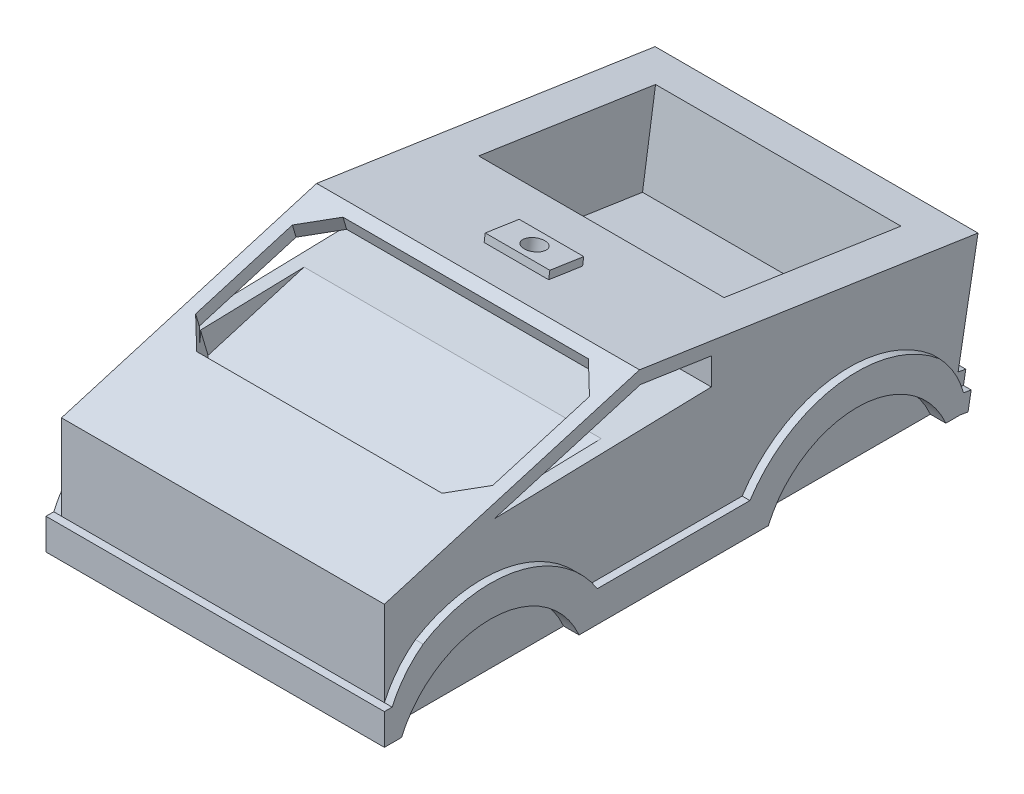
from build123d import *

# Parameters (mm, degrees)
BOSS_EXTRUDE1_DEPTH = 125
CUT_EXTRUDE1_DEPTH  = 17
SKETCH3_W           = 95
SKETCH3_H           = 69.22757419
CUT_EXTRUDE2_DEPTH  = 34
SKETCH4_W           = 25
SKETCH4_H           = 13.27242581
BOSS_EXTRUDE2_DEPTH = 3
SKETCH5_R           = 4
CUT_EXTRUDE3_DEPTH  = 26
SKETCH6_R           = 37.5
CUT_EXTRUDE4_DEPTH  = 3
BOSS_EXTRUDE3_DEPTH = 3
BOSS_EXTRUDE4_DEPTH = 3
BOSS_EXTRUDE5_DEPTH = 3


with BuildPart() as part:
    # Sketch1 → Boss-Extrude1 (new body)
    with BuildSketch(Plane(origin=(0, 0, 0), x_dir=(0, 0, -1), z_dir=(1, 0, 0))):
        Polygon((0, 0), (-220, 0), (-220, 45), (-121.223885949, 74.203491429), (9.810612088, 54.551256842), align=None)
        Polygon((-177.49762675, 52.35202023), (-120.869266543, 69.094386012), (-93.423815393, 64.978184153), (-93.423815393, 54.551256842), align=None, mode=Mode.SUBTRACT)
    extrude(amount=-BOSS_EXTRUDE1_DEPTH)

    # Sketch2 → Cut-Extrude1 (cut)
    with BuildSketch(Plane(origin=(0, 101.19793775, 29.919511777), x_dir=(1, 0, 0), z_dir=(0, 0.9589658804644564, 0.28352149848826236))):
        Polygon((-110, -159.280040992), (-15, -159.280040992), (-5, -149.280040992), (-5, -110.211285439), (-15, -100.211285439), (-110, -100.211285439), (-120, -110.211285439), (-120, -149.280040992), align=None)
    extrude(amount=-CUT_EXTRUDE1_DEPTH, mode=Mode.SUBTRACT)

    # Sketch3 → Cut-Extrude2 (cut)
    with BuildSketch(Plane(origin=(0, 54.790217418, -8.217303244), x_dir=(1, 0, 0), z_dir=(0, 0.9889396078246219, -0.1483187515983168))):
        with Locations((-62.5, -48.002658537)):
            Rectangle(SKETCH3_W, SKETCH3_H)
    extrude(amount=-CUT_EXTRUDE2_DEPTH, mode=Mode.SUBTRACT)

    # Sketch4 → Boss-Extrude2 (add)
    with BuildSketch(Plane(origin=(0, 54.790217418, -8.217303244), x_dir=(1, 0, 0), z_dir=(0, 0.9889396078246219, -0.1483187515983168))):
        with Locations((-62.5, -109.252658537)):
            Rectangle(SKETCH4_W, SKETCH4_H)
    extrude(amount=BOSS_EXTRUDE2_DEPTH)

    # Sketch5 → Cut-Extrude3 (cut)
    with BuildSketch(Plane(origin=(0, 57.757036242, -8.662259499), x_dir=(1, 0, 0), z_dir=(0, 0.988939607824622, -0.1483187515983164))):
        with Locations(Location((-62.5, -109.252658537, 0), (0, 0, 270))):
            Circle(SKETCH5_R)
    extrude(amount=-CUT_EXTRUDE3_DEPTH, mode=Mode.SUBTRACT)

    # Sketch6 → Cut-Extrude4 (cut)
    with BuildSketch(Plane(origin=(0, 0, 0), x_dir=(0, 0, -1), z_dir=(1, 0, 0))):
        with Locations((-182, -15)):
            Circle(SKETCH6_R)
        with Locations((-40, -15)):
            Circle(SKETCH6_R)
    cut_extrude4 = extrude(amount=-CUT_EXTRUDE4_DEPTH, mode=Mode.SUBTRACT)

    # Mirror1: Cut-Extrude4 across plane
    add(cut_extrude4.mirror(Plane(origin=(-62.5, 0, 0), x_dir=(0, 0, 1), z_dir=(1, 0, 0))), mode=Mode.SUBTRACT)

    # Sketch7 → Boss-Extrude3 (add)
    with BuildSketch(Plane.XY.offset(220)):
        Polygon((-113, 12), (-125, 12), (-125, 0), (0, 0), (0, 12), (-12, 12), align=None)
    extrude(amount=BOSS_EXTRUDE3_DEPTH)

    # Sketch8 → Boss-Extrude4 (add)
    with BuildSketch(Plane(origin=(0, 0, 0), x_dir=(0, 0, -1), z_dir=(1, 0, 0))):
        with BuildLine():
            Line((-81.487950058, 12), (-140.512049942, 12))
            ThreePointArc((-140.512049942, 12), (-171.177028416, 33.302311395), (-208, 27.121847063))
            ThreePointArc((-208, 27.121847063), (-214.976280656, 20.335654808), (-220, 12))
            Line((-220, 12), (-223, 12))
            Line((-223, 12), (-223, 0))
            Line((-223, 0), (-216.369317712, 0))
            ThreePointArc((-216.369317712, 0), (-182, 22.5), (-147.630682288, 0))
            Line((-147.630682288, 0), (-74.369317712, 0))
            ThreePointArc((-74.369317712, 0), (-40, 22.5), (-5.630682288, 0))
            Line((-5.630682288, 0), (0, 0))
            Line((0, 0), (1.221081194, 6.789740871))
            ThreePointArc((1.221081194, 6.789740871), (-2.437755356, 15.390427261), (-8.085309053, 22.837844835))
            ThreePointArc((-8.085309053, 22.837844835), (-47.230251909, 33.969107173), (-81.487950058, 12))
        make_face()
    boss_extrude4 = extrude(amount=BOSS_EXTRUDE4_DEPTH)

    # Mirror2: Boss-Extrude4 across plane
    add(boss_extrude4.mirror(Plane(origin=(-62.5, 0, 0), x_dir=(0, 0, 1), z_dir=(1, 0, 0))))

    # Sketch9 → Boss-Extrude5 (add)
    with BuildSketch(Plane(origin=(0, 0, 0), x_dir=(-1, 0, 0), z_dir=(0, -0.17700245783771668, -0.9842104093736296))):
        Polygon((12, 12), (0, 12), (0, 6.898668015), (-3, 6.898668015), (-3, 0), (128, 0), (128, 6.898668015), (125, 6.898668015), (125, 12), (113, 12), align=None)
    extrude(amount=BOSS_EXTRUDE5_DEPTH)


solid = part.part
